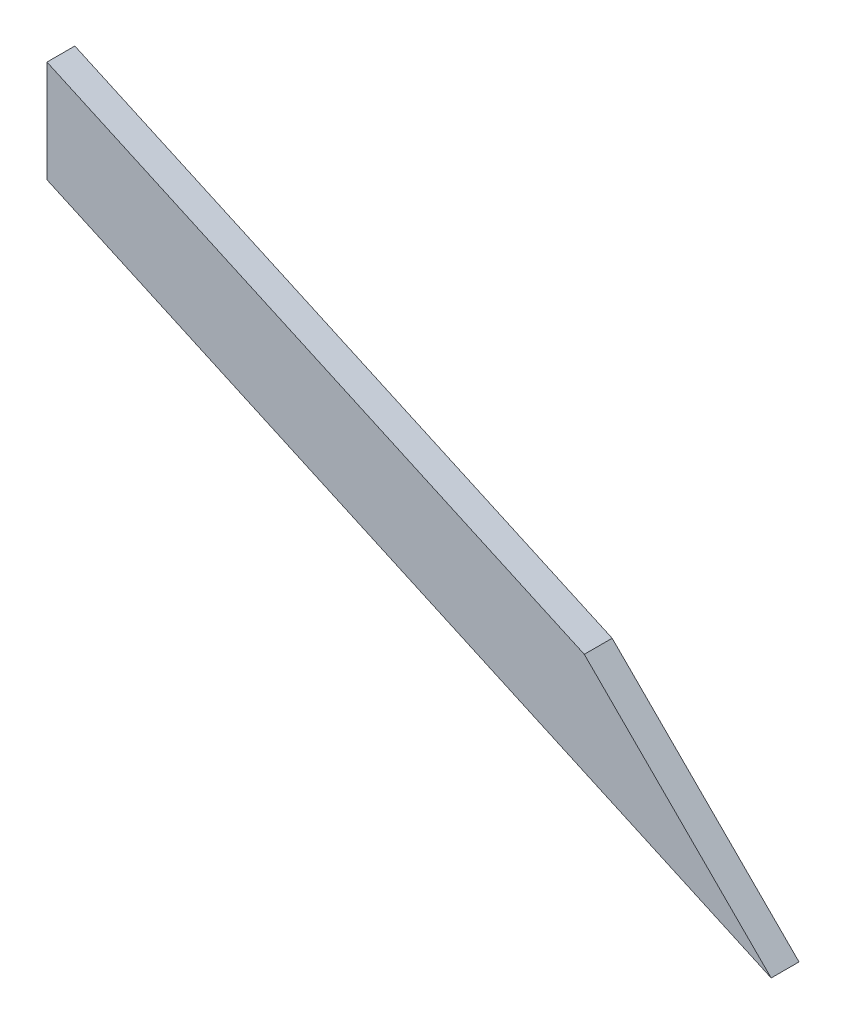
from build123d import *

# Parameters (mm, degrees)
BOSS_EXTRUDE1_DEPTH = 19.05


with BuildPart() as part:
    # Sketch5 → Boss-Extrude1 (new body)
    with BuildSketch(Plane.XY):
        Polygon((-737.18449825, 1692.941033519), (-737.18449825, 1762.693162548), (-369.50989641, 1595.56834353), (-241.630993189, 1467.68944031), align=None)
    extrude(amount=BOSS_EXTRUDE1_DEPTH)


solid = part.part
